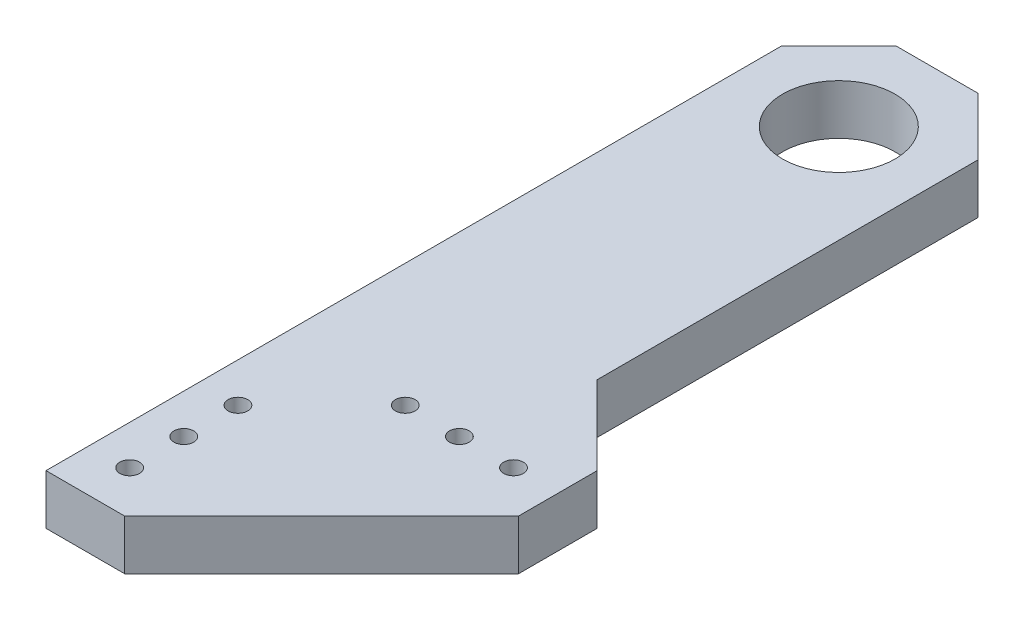
from build123d import *

# Parameters (mm, degrees)
SKETCH1_R           = 14.2875
SKETCH1_R_2         = 2.5
BOSS_EXTRUDE1_DEPTH = 6.35


with BuildPart() as part:
    # Sketch1 → Boss-Extrude1 (new, symmetric)
    with BuildSketch(Plane(origin=(0, 0, 0), x_dir=(1, 0, 0), z_dir=(0, 1, 0))):
        Polygon((-10, -60), (10, -60), (60, -10), (60, 10), (40, 30), (40, 126.725339059), (25.355339059, 141.37), (4.644660941, 141.37), (-10, 126.725339059), align=None)
        with Locations(Location((15, 116.37, 0), (0, 0, 270))):
            Circle(SKETCH1_R, mode=Mode.SUBTRACT)
        with Locations(Location((48.75, 0, 0), (0, 0, 270))):
            Circle(SKETCH1_R_2, mode=Mode.SUBTRACT)
        with Locations(Location((35, 0, 0), (0, 0, 270))):
            Circle(SKETCH1_R_2, mode=Mode.SUBTRACT)
        with Locations(Location((21.25, 0, 0), (0, 0, 270))):
            Circle(SKETCH1_R_2, mode=Mode.SUBTRACT)
        with Locations(Location((0, -48.75, 0), (0, 0, 270))):
            Circle(SKETCH1_R_2, mode=Mode.SUBTRACT)
        with Locations(Location((0, -35, 0), (0, 0, 270))):
            Circle(SKETCH1_R_2, mode=Mode.SUBTRACT)
        with Locations(Location((0, -21.25, 0), (0, 0, 270))):
            Circle(SKETCH1_R_2, mode=Mode.SUBTRACT)
    extrude(amount=BOSS_EXTRUDE1_DEPTH, both=True)


solid = part.part
